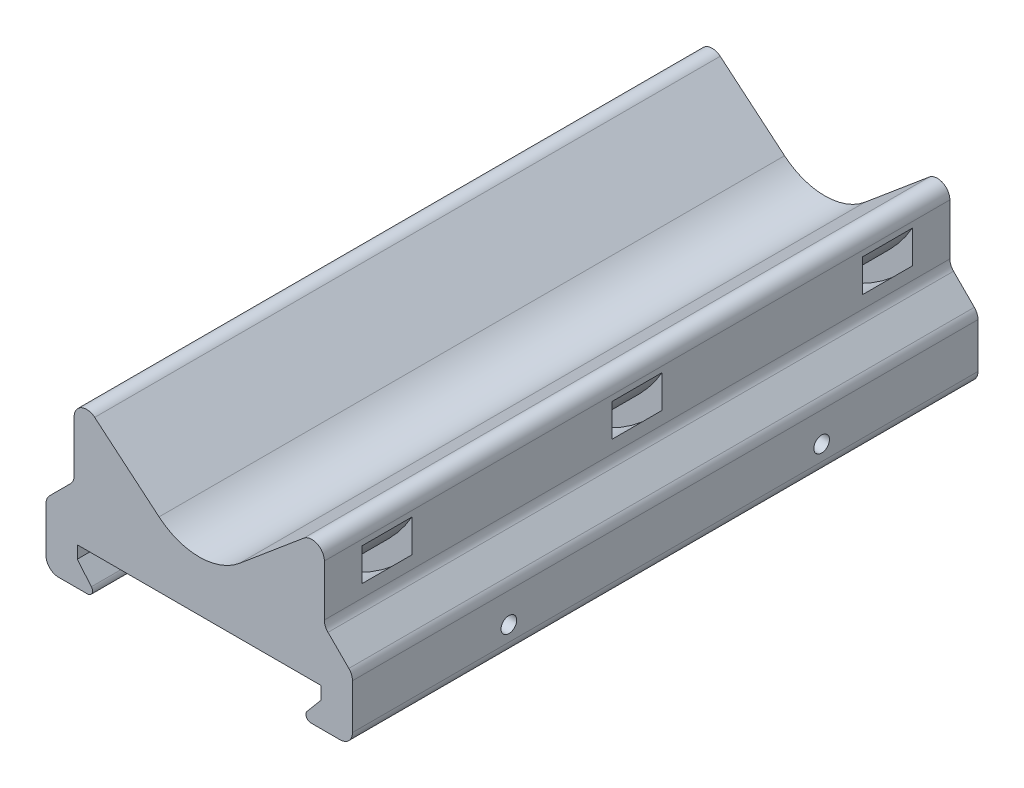
from build123d import *

# Parameters (mm, degrees)
BOSS_EXTRUDE1_DEPTH             = 100
SKETCH2_W                       = 8
SKETCH2_H                       = 3
M3X0_5_TAPPED_HOLE1_D           = 2.5
M3X0_5_TAPPED_HOLE1_CSINK_D     = 3.05
M3X0_5_TAPPED_HOLE1_CSINK_ANGLE = 90


with BuildPart() as part:
    # Sketch1 → Boss-Extrude1 (new body)
    with BuildSketch(Plane.XY):
        with BuildLine():
            Line((6.427876097, 10.393628462), (16.714424781, 19.025067669))
            ThreePointArc((16.714424781, 19.025067669), (18.845236523, 19.305594357), (20, 17.492978783))
            Line((20, 17.492978783), (20, 9.328427125))
            ThreePointArc((20, 9.328427125), (20.152240935, 8.56306026), (20.585786438, 7.914213562))
            Line((20.585786438, 7.914213562), (23.914213562, 4.585786438))
            ThreePointArc((23.914213562, 4.585786438), (24.347759065, 3.93693974), (24.5, 3.171572875))
            Line((24.5, 3.171572875), (24.5, -4))
            ThreePointArc((24.5, -4), (23.914213562, -5.414213562), (22.5, -6))
            Line((22.5, -6), (17.859207012, -6))
            ThreePointArc((17.859207012, -6), (17.134160782, -5.538094609), (17.246371457, -4.685769912))
            Line((17.246371457, -4.685769912), (19.5, -2))
            Line((19.5, -2), (19.5, 0))
            Line((19.5, 0), (-19.5, 0))
            Line((-19.5, 0), (-19.5, -2))
            Line((-19.5, -2), (-17.246371457, -4.685769912))
            ThreePointArc((-17.246371457, -4.685769912), (-17.134160782, -5.538094609), (-17.859207012, -6))
            Line((-17.859207012, -6), (-22.5, -6))
            ThreePointArc((-22.5, -6), (-23.914213562, -5.414213562), (-24.5, -4))
            Line((-24.5, -4), (-24.5, 3.171572875))
            ThreePointArc((-24.5, 3.171572875), (-24.347759065, 3.93693974), (-23.914213562, 4.585786438))
            Line((-23.914213562, 4.585786438), (-20.585786438, 7.914213562))
            ThreePointArc((-20.585786438, 7.914213562), (-20.152240935, 8.56306026), (-20, 9.328427125))
            Line((-20, 9.328427125), (-20, 17.492978783))
            ThreePointArc((-20, 17.492978783), (-18.845236523, 19.305594357), (-16.714424781, 19.025067669))
            Line((-16.714424781, 19.025067669), (-6.427876097, 10.393628462))
            ThreePointArc((-6.427876097, 10.393628462), (0, 8.054072893), (6.427876097, 10.393628462))
        make_face()
    extrude(amount=BOSS_EXTRUDE1_DEPTH)

    # Sketch2 → Cut-Revolve1 (revolve, cut)
    with BuildSketch(Plane(origin=(0, 0, 0), x_dir=(0, 0, -1), z_dir=(1, 0, 0))):
        with Locations((-10, 3.5)):
            Rectangle(SKETCH2_W, SKETCH2_H)
        with Locations((-50, 3.5)):
            Rectangle(SKETCH2_W, SKETCH2_H)
        with Locations((-90, 3.5)):
            Rectangle(SKETCH2_W, SKETCH2_H)
    revolve(axis=Axis((0, 28.054072893, 89.353848425), (0, 0, -1)), mode=Mode.SUBTRACT)

    # M3x0.5 Tapped Hole1 (through all)
    with Locations(Plane.ZY.offset(24.5)):
        with Locations((25, -1.555540573), (75, -1.555540573)):
            CounterSinkHole(M3X0_5_TAPPED_HOLE1_D / 2, M3X0_5_TAPPED_HOLE1_CSINK_D / 2, counter_sink_angle=M3X0_5_TAPPED_HOLE1_CSINK_ANGLE)


solid = part.part
